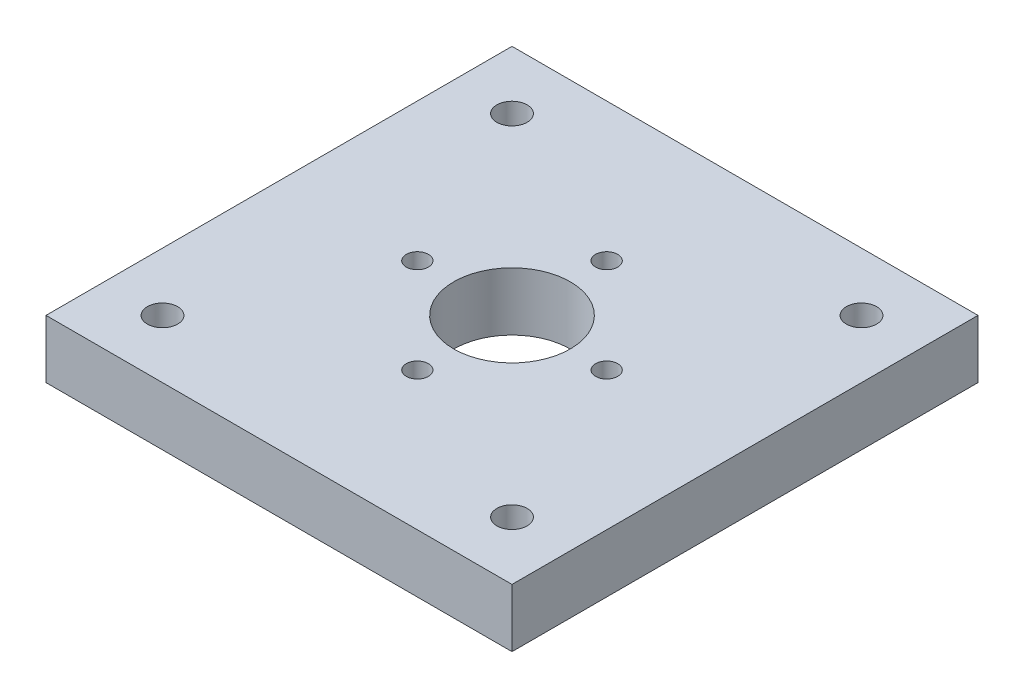
from build123d import *

# Parameters (mm, degrees)
SKETCH1_W           = 4
SKETCH1_H           = 4
SKETCH1_R           = 0.13
SKETCH1_R_2         = 0.5
SKETCH1_R_3         = 0.095
BOSS_EXTRUDE1_DEPTH = 0.5


with BuildPart() as part:
    # Sketch1 → Boss-Extrude1 (new body)
    with BuildSketch(Plane(origin=(0, 0, 0), x_dir=(1, 0, 0), z_dir=(0, 1, 0))):
        Rectangle(SKETCH1_W, SKETCH1_H)
        with Locations(Location((-1.5, 1.5, 0), (0, 0, 270))):
            Circle(SKETCH1_R, mode=Mode.SUBTRACT)
        with Locations(Location((1.5, 1.5, 0), (0, 0, 90))):
            Circle(SKETCH1_R, mode=Mode.SUBTRACT)
        with Locations(Location((1.5, -1.5, 0), (0, 0, 270))):
            Circle(SKETCH1_R, mode=Mode.SUBTRACT)
        with Locations(Location((-1.5, -1.5, 0), (0, 0, 90))):
            Circle(SKETCH1_R, mode=Mode.SUBTRACT)
        with Locations(Location((0, 0, 0), (0, 0, 270))):
            Circle(SKETCH1_R_2, mode=Mode.SUBTRACT)
        with Locations(Location((0, 0.8125, 0), (0, 0, 270))):
            Circle(SKETCH1_R_3, mode=Mode.SUBTRACT)
        with Locations(Location((0.8125, 0, 0), (0, 0, 270))):
            Circle(SKETCH1_R_3, mode=Mode.SUBTRACT)
        with Locations(Location((0, -0.8125, 0), (0, 0, 270))):
            Circle(SKETCH1_R_3, mode=Mode.SUBTRACT)
        with Locations(Location((-0.8125, 0, 0), (0, 0, 270))):
            Circle(SKETCH1_R_3, mode=Mode.SUBTRACT)
    extrude(amount=BOSS_EXTRUDE1_DEPTH)


solid = part.part
